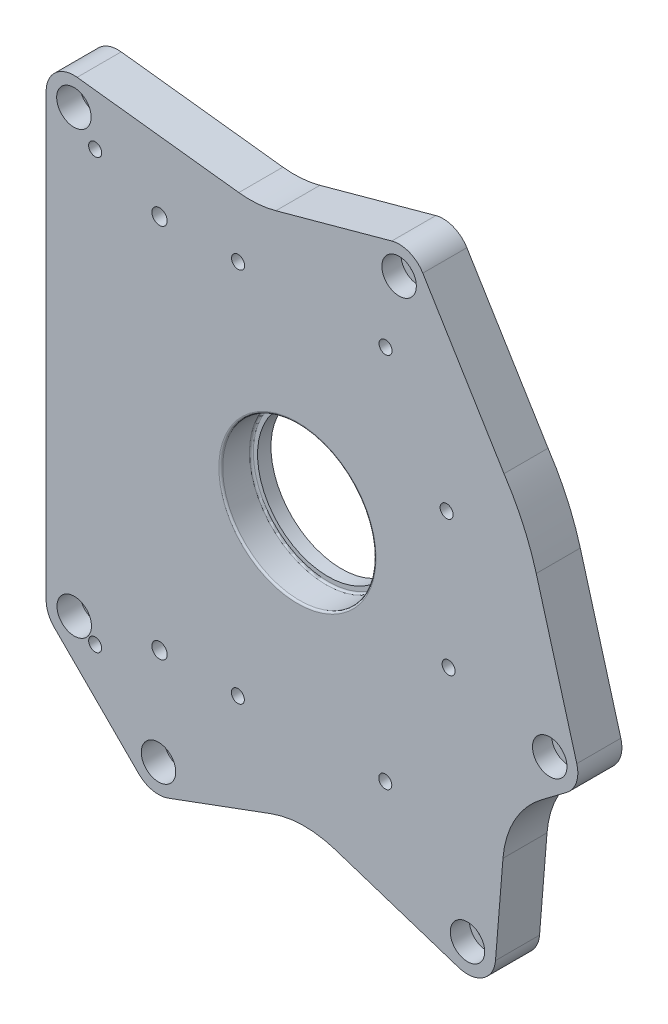
from build123d import *

# Parameters (mm, degrees)
BOSS_EXTRUDE1_DEPTH             = 23
FILLET2_R                       = 50.8
SKETCH2_R                       = 40.05
CUT_EXTRUDE1_DEPTH              = 16
SKETCH5_R                       = 36.83
CUT_EXTRUDE2_DEPTH              = 25.4
FILLET5_R                       = 1
FILLET6_R                       = 1
CBORE_FOR_M10_SHCS7_D           = 10.5
CBORE_FOR_M10_SHCS7_CBORE_D     = 18
CBORE_FOR_M10_SHCS7_CBORE_DEPTH = 12
TAP_DRILL_FOR_M8X1_25_TAP2_D    = 6.8
F_8_0MM_DOWEL_HOLE1_D           = 8
F_8_0MM_DOWEL_HOLE1_DEPTH       = 9
F_8_0MM_DOWEL_HOLE1_TIP         = 2.403442476
F_10_0MM_DOWEL_HOLE3_D          = 10
F_10_0MM_DOWEL_HOLE3_DEPTH      = 10
F_10_0MM_DOWEL_HOLE3_TIP        = 3.004303095
CBORE_FOR_M10_SHCS9_D           = 10.5
CBORE_FOR_M10_SHCS9_CBORE_D     = 18
CBORE_FOR_M10_SHCS9_CBORE_DEPTH = 10


with BuildPart() as part:
    # Sketch1 → Boss-Extrude1 (new body)
    with BuildSketch(Plane.XY):
        with BuildLine():
            Line((84.221105008, -163.490124242), (2.699306526, -136.831626991))
            Line((2.699306526, -136.831626991), (-67.458438584, -162.730244564))
            ThreePointArc((-67.458438584, -162.730244564), (-75.680634631, -163.297391653), (-82.910842941, -159.341351783))
            Line((-82.910842941, -159.341351783), (-126.914053579, -115.336397895))
            ThreePointArc((-126.914053579, -115.336397895), (-130.093640928, -110.577690662), (-131.210211433, -104.964461595))
            Line((-131.210211433, -104.964461595), (-131.213297338, 125.035476514))
            ThreePointArc((-131.213297338, 125.035476514), (-126.350161673, 135.869915187), (-115.02264263, 139.436771249))
            Line((-115.02264263, 139.436771249), (-20.796830867, 128.37488637))
            Line((-20.796830867, 128.37488637), (49.24312976, 147.55277548))
            ThreePointArc((49.24312976, 147.55277548), (58.421803723, 147.044752766), (65.450410839, 141.119820294))
            Line((65.450410839, 141.119820294), (107.841002341, 71.642808501))
            ThreePointArc((107.841002341, 71.642808501), (117.701476238, 53.952608996), (124.683759391, 34.941564155))
            Line((124.683759391, 34.941564155), (145.845410308, -40.455794779))
            ThreePointArc((145.845410308, -40.455794779), (145.61886709, -49.11646402), (140.544799405, -56.138739339))
            Line((140.544799405, -56.138739339), (109.149264581, -79.773969292))
            Line((109.149264581, -79.773969292), (103.401152517, -150.732337669))
            ThreePointArc((103.401152517, -150.732337669), (96.90432541, -161.761540655), (84.221105008, -163.490124242))
        make_face()
    extrude(amount=BOSS_EXTRUDE1_DEPTH)

    # Fillet2
    fillet2_edges = [part.edges().sort_by_distance(p)[0] for p in [
        (109.149264581, -79.773969292, 11.5),
        (2.699306526, -136.831626991, 11.5),
        (-20.796830867, 128.37488637, 11.5),
    ]]
    fillet(fillet2_edges, radius=FILLET2_R)

    # Sketch2 → Cut-Extrude1 (cut)
    with BuildSketch(Plane(origin=(0, 0, 23), x_dir=(-1, 0, 0), z_dir=(0, 0, -1))):
        Circle(SKETCH2_R)
    extrude(amount=CUT_EXTRUDE1_DEPTH, mode=Mode.SUBTRACT)

    # Sketch5 → Cut-Extrude2 (cut)
    with BuildSketch(Plane(origin=(0, 0, 23), x_dir=(-1, 0, 0), z_dir=(0, 0, -1))):
        with Locations(Location((0, 0, 0), (0, 0, 180))):
            Circle(SKETCH5_R)
    extrude(amount=CUT_EXTRUDE2_DEPTH, mode=Mode.SUBTRACT)

    # Fillet5
    fillet5_edges = [part.edges().sort_by_distance(p)[0] for p in [
        (40.05, 0, 23),
    ]]
    fillet(fillet5_edges, radius=FILLET5_R)

    # Fillet6
    fillet6_edges = [part.edges().sort_by_distance(p)[0] for p in [
        (40.05, 0, 7),
    ]]
    fillet(fillet6_edges, radius=FILLET6_R)

    # CBORE for M10 SHCS7 (through all)
    with Locations(Plane.XY.offset(23)):
        with Locations((-116.713297339, 125.03567106), (-116.541509562, -104.964264785), (-72.538298924, -148.969218673)):
            CounterBoreHole(CBORE_FOR_M10_SHCS7_D / 2, CBORE_FOR_M10_SHCS7_CBORE_D / 2, CBORE_FOR_M10_SHCS7_CBORE_DEPTH)

    # Tap Drill for M8x1.25 Tap2 (through all)
    with Locations(Plane.XY.offset(23)):
        with Locations((46, 97.92), (-31, 98), (-105.616623552, 111.626092354), (-105.616623552, -112.292869781), (-31.12, -98.35), (45.85, -98.52), (78.925, -30.46), (77.9, 39.75)):
            Hole(TAP_DRILL_FOR_M8X1_25_TAP2_D / 2)

    # Ø8.0mm Dowel Hole1
    with Locations(Plane.XY.offset(23)):
        with Locations((-72, 97.977867106), (-72, -98.122132894)):
            Hole(F_8_0MM_DOWEL_HOLE1_D / 2, depth=F_8_0MM_DOWEL_HOLE1_DEPTH)
            with Locations((0, 0, -(F_8_0MM_DOWEL_HOLE1_DEPTH + F_8_0MM_DOWEL_HOLE1_TIP / 2))):  # 118° drill point
                Cone(0, F_8_0MM_DOWEL_HOLE1_D / 2, F_8_0MM_DOWEL_HOLE1_TIP, mode=Mode.SUBTRACT)

    # Ø10.0mm Dowel Hole3
    with Locations(Plane(origin=(0, 0, 0), x_dir=(-1, 0, 0), z_dir=(0, 0, -1))):
        with Locations((76.55340813, 103.753913834), (-59.102558089, -114.980445858)):
            Hole(F_10_0MM_DOWEL_HOLE3_D / 2, depth=F_10_0MM_DOWEL_HOLE3_DEPTH)
            with Locations((0, 0, -(F_10_0MM_DOWEL_HOLE3_DEPTH + F_10_0MM_DOWEL_HOLE3_TIP / 2))):  # 118° drill point
                Cone(0, F_10_0MM_DOWEL_HOLE3_D / 2, F_10_0MM_DOWEL_HOLE3_TIP, mode=Mode.SUBTRACT)

    # CBORE for M10 SHCS9 (through all)
    with Locations(Plane.XY.offset(23)):
        with Locations((53.072470058, 133.567563544), (131.722431635, -44.419667636), (88.780343848, -149.547952394)):
            CounterBoreHole(CBORE_FOR_M10_SHCS9_D / 2, CBORE_FOR_M10_SHCS9_CBORE_D / 2, CBORE_FOR_M10_SHCS9_CBORE_DEPTH)


solid = part.part
